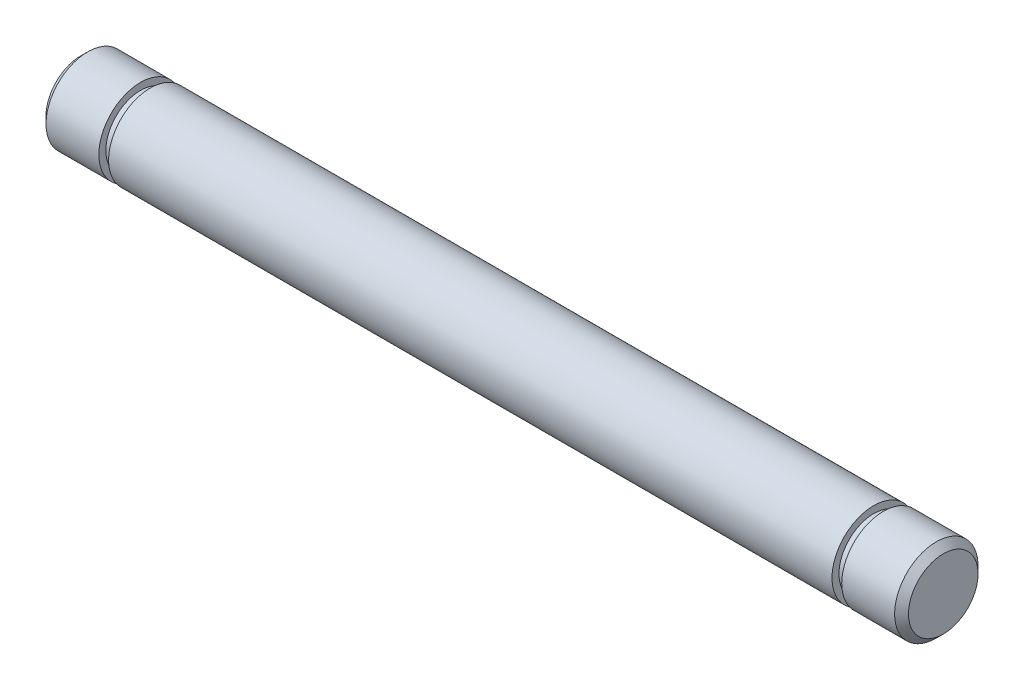
from build123d import *

# Parameters (mm, degrees)
SKETCH_2_R          = 6
SKETCH_2_R_2        = 2.5
CUT_EXTRUDE_1_DEPTH = 0.7
CUT_EXTRUDE_START   = 0.7
SKETCH_3_R          = 6
SKETCH_3_R_2        = 2.5
CUT_EXTRUDE_2_DEPTH = 0.7


with BuildPart() as part:
    # ｽｹｯﾁ1 → 回転1 (revolve)
    with BuildSketch(Plane.XY, mode=Mode.PRIVATE) as revolve_1_sk:
        Polygon((0, 0), (0, 2.5), (0.5, 3), (61.5, 3), (62, 2.5), (62, 0), align=None)
    revolve(revolve_1_sk.sketch.rotate(Axis((62, 0, 0), (-1, 0, 0)), 270), axis=Axis((62, 0, 0), (-1, 0, 0)))

    # ｽｹｯﾁ2 → ｶｯﾄ - 押し出し1 (cut)
    with BuildSketch(Plane(origin=(5, 0, 0), x_dir=(0, 0, -1), z_dir=(1, 0, 0))):
        Circle(SKETCH_2_R)
        Circle(SKETCH_2_R_2, mode=Mode.SUBTRACT)
    extrude(amount=-CUT_EXTRUDE_1_DEPTH, mode=Mode.SUBTRACT)

    # ｽｹｯﾁ3 → ｶｯﾄ - 押し出し2 (cut)
    with BuildSketch(Plane(origin=(57, 0, 0), x_dir=(0, 0, -1), z_dir=(1, 0, 0)).offset(CUT_EXTRUDE_START)):
        Circle(SKETCH_3_R)
        Circle(SKETCH_3_R_2, mode=Mode.SUBTRACT)
    extrude(amount=-CUT_EXTRUDE_2_DEPTH, mode=Mode.SUBTRACT)


solid = part.part
